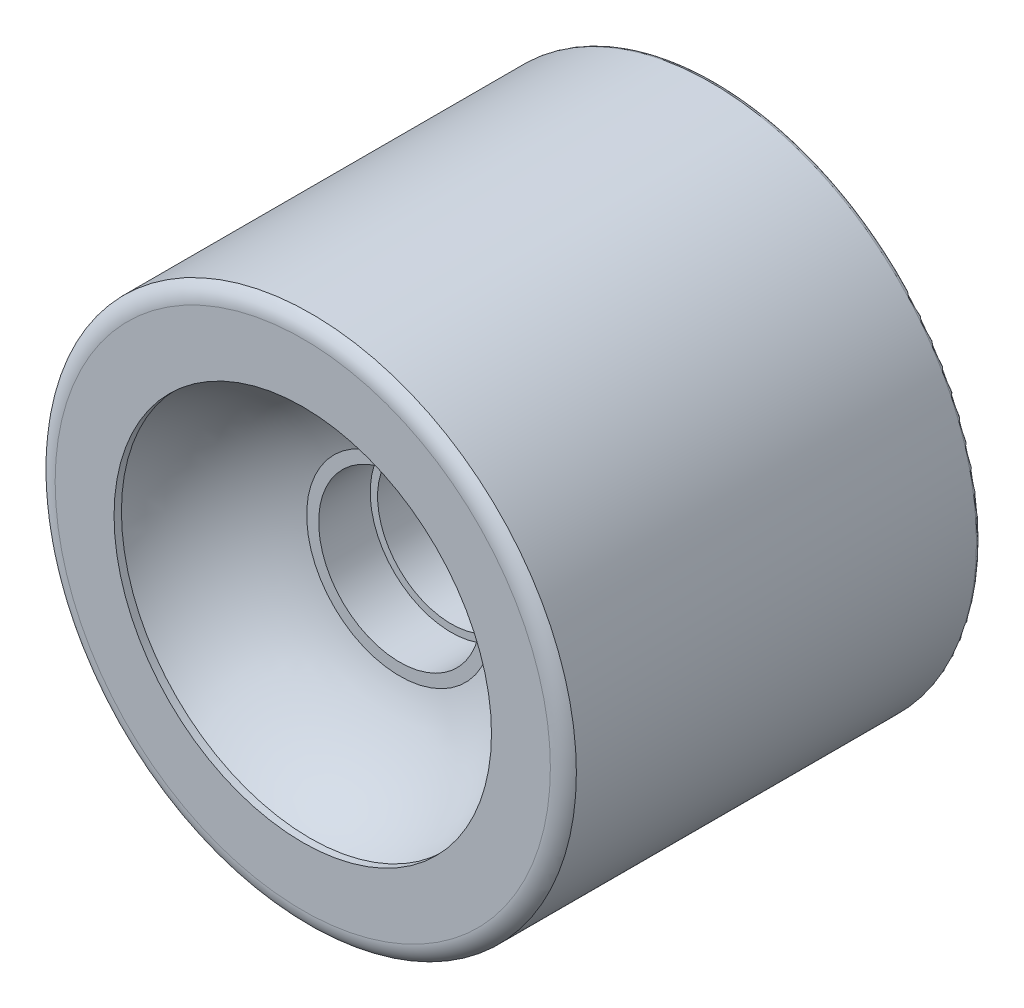
from build123d import *

# Parameters (mm, degrees)
FILLET1_R = 0.5


with BuildPart() as part:
    # Sketch1 → Revolve1 (revolve)
    with BuildSketch(Plane(origin=(0, 0, 0), x_dir=(1, 0, 0), z_dir=(0, 1, 0))):
        with BuildLine():
            Line((36, 56), (36, 1.160679473))
            ThreePointArc((36, 1.160679473), (34.94947687, 0.305750422), (33.63, 0))
            Line((33.63, 0), (25.63, 0))
            Line((25.63, 0), (25.63, 1))
            ThreePointArc((25.63, 1), (20.557422009, 8.606026819), (12.63, 13.16))
            Line((12.63, 13.16), (11, 13.16))
            Line((11, 13.16), (11, 20.16))
            Line((11, 20.16), (10, 20.16))
            Line((10, 20.16), (10, 30.16))
            Line((10, 30.16), (11, 30.16))
            Line((11, 30.16), (11, 37.16))
            Line((11, 37.16), (12.63, 37.16))
            ThreePointArc((12.63, 37.16), (12.964344278, 38.760927271), (13.911484064, 40.094224107))
            Line((13.911484064, 40.094224107), (30, 55))
            Line((30, 55), (30, 56))
            Line((30, 56), (36, 56))
        make_face()
    revolve(axis=Axis((0, 0, 0), (0, 0, -1)))

    # Fillet1
    fillet1_edges = [part.edges().sort_by_distance(p)[0] for p in [
        (-36, 0, -56),
    ]]
    fillet(fillet1_edges, radius=FILLET1_R)


solid = part.part
